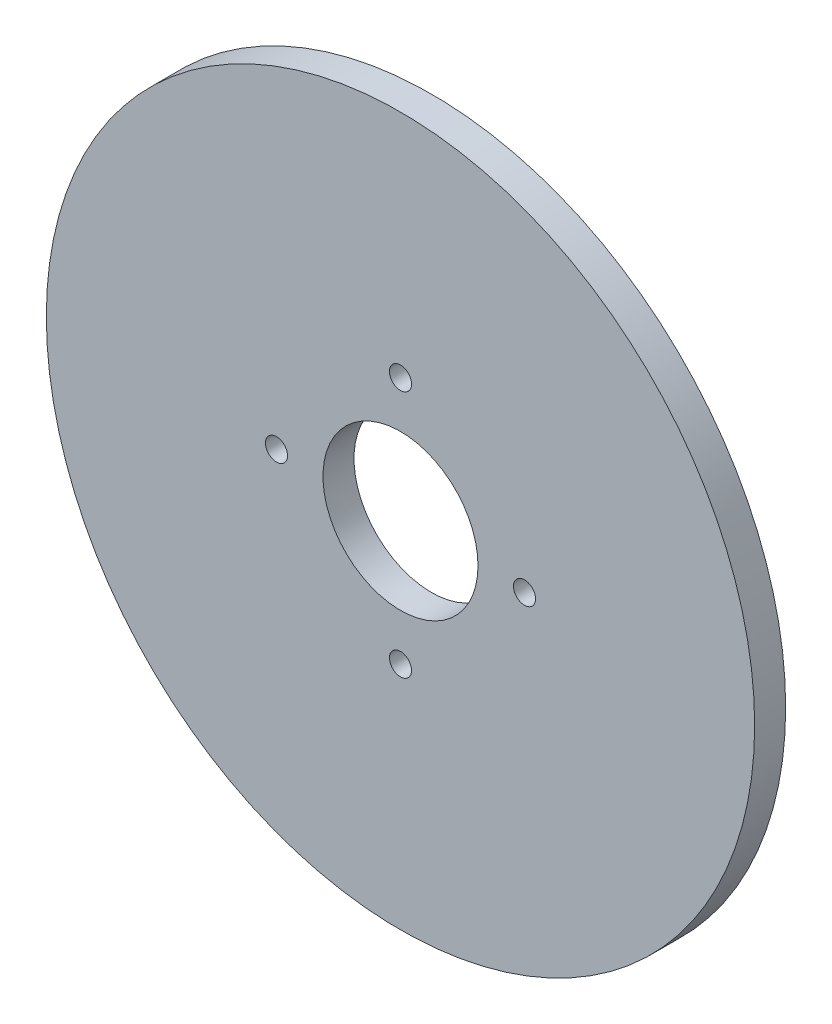
from build123d import *

# Parameters (mm, degrees)
SKETCH1_R                     = 36.2712
SKETCH1_R_2                   = 7.9375
BOSS_EXTRUDE1_DEPTH           = 3.175
TAP_DRILL_FOR_4_40_TAP1_D     = 2.2606
TAP_DRILL_FOR_4_40_TAP1_DEPTH = 4
TAP_DRILL_FOR_4_40_TAP1_TIP   = 0.679152758


with BuildPart() as part:
    # Sketch1 → Boss-Extrude1 (new body)
    with BuildSketch(Plane.XY):
        Circle(SKETCH1_R)
        Circle(SKETCH1_R_2, mode=Mode.SUBTRACT)
    extrude(amount=BOSS_EXTRUDE1_DEPTH)

    # Tap Drill for #4-40 Tap1
    with Locations(Plane.XY.offset(3.175)):
        with Locations((0, 12.7), (0, -12.7), (12.7, 0), (-12.7, 0)):
            Hole(TAP_DRILL_FOR_4_40_TAP1_D / 2, depth=TAP_DRILL_FOR_4_40_TAP1_DEPTH)
            with Locations((0, 0, -(TAP_DRILL_FOR_4_40_TAP1_DEPTH + TAP_DRILL_FOR_4_40_TAP1_TIP / 2))):  # 118° drill point
                Cone(0, TAP_DRILL_FOR_4_40_TAP1_D / 2, TAP_DRILL_FOR_4_40_TAP1_TIP, mode=Mode.SUBTRACT)


solid = part.part
